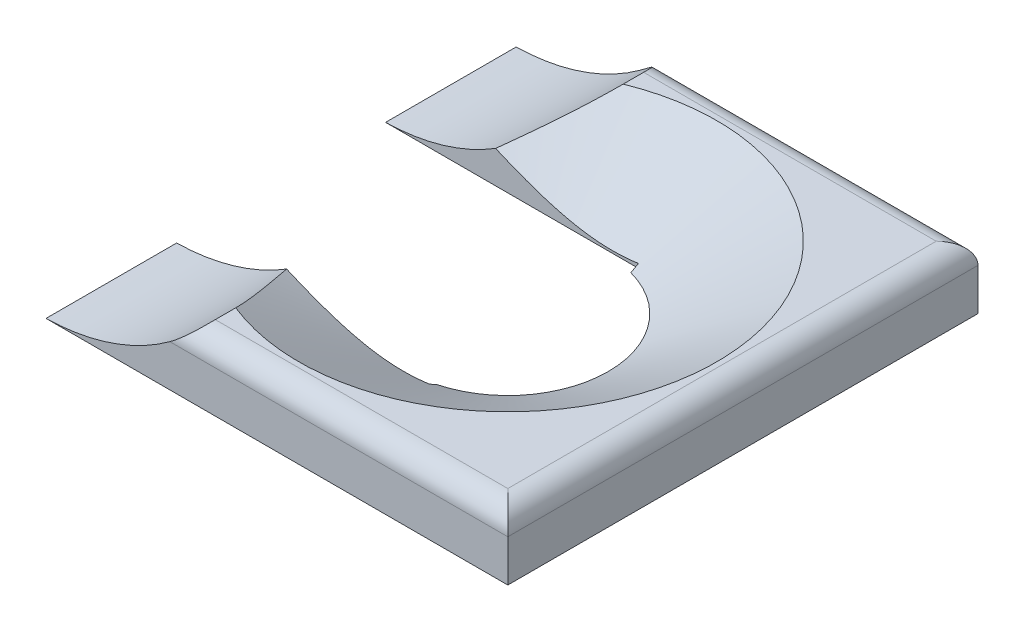
from build123d import *

# Parameters (mm, degrees)
SKETCH1_W           = 45
SKETCH1_H           = 45
BOSS_EXTRUDE1_DEPTH = 6
SKETCH2_R           = 20
CUT_EXTRUDE1_DEPTH  = 6
CUT_EXTRUDE1_DRAFT  = -60
FILLET2_R           = 2
CUT_EXTRUDE2_DEPTH  = 1000
SKETCH5_W           = 20
SKETCH5_H           = 6
CUT_EXTRUDE3_DEPTH  = 25


with BuildPart() as part:
    # Sketch1 → Boss-Extrude1 (new body)
    with BuildSketch(Plane(origin=(0, 0, 0), x_dir=(1, 0, 0), z_dir=(0, 1, 0))):
        with Locations((22.5, 22.5)):
            Rectangle(SKETCH1_W, SKETCH1_H)
    extrude(amount=-BOSS_EXTRUDE1_DEPTH)


with BuildPart() as cut_extrude1_tool:
    # Sketch2 → Cut-Extrude1 (with draft: the straight prism first)
    with BuildSketch(Plane(origin=(0, 0, 0), x_dir=(1, 0, 0), z_dir=(0, 1, 0))):
        with Locations((22.5, 22.5)):
            Circle(SKETCH2_R)
    extrude(amount=-CUT_EXTRUDE1_DEPTH)
    # Cut-Extrude1: the draft: its side faces are tilted about the plane it starts from
    cut_extrude1_sides = [cut_extrude1_tool.faces().sort_by_distance(p)[0] for p in [
        (2.5, -3, -22.5),
    ]]
    draft(cut_extrude1_sides, Plane(origin=(0, 0, 0), x_dir=(1, 0, 0), z_dir=(0, 1, 0)), CUT_EXTRUDE1_DRAFT)


with BuildPart() as part_1:
    add(part.part)

    # Cut-Extrude1: cut by cut_extrude1_tool
    add(cut_extrude1_tool.part, mode=Mode.SUBTRACT)

    # Fillet2
    fillet2_edges = [part_1.edges().sort_by_distance(p)[0] for p in [
        (22.5, 0, -45),
        (45, 0, -22.5),
        (22.5, 0, 0),
    ]]
    fillet(fillet2_edges, radius=FILLET2_R)

    # Sketch4 → Cut-Extrude2 (cut)
    with BuildSketch(Plane.XY):
        with BuildLine():
            Line((0, 0), (15, 0))
            ThreePointArc((15, 0), (8.107772818, -4.519432044), (0, -6))
            Line((0, -6), (0, 0))
        make_face()
    extrude(amount=-CUT_EXTRUDE2_DEPTH, mode=Mode.SUBTRACT)

    # Sketch5 → Cut-Extrude3 (cut)
    with BuildSketch(Plane(origin=(0, 0, 0), x_dir=(0, 0, -1), z_dir=(1, 0, 0))):
        with Locations((22.5, -3)):
            Rectangle(SKETCH5_W, SKETCH5_H)
    extrude(amount=CUT_EXTRUDE3_DEPTH, mode=Mode.SUBTRACT)


solid = part_1.part
